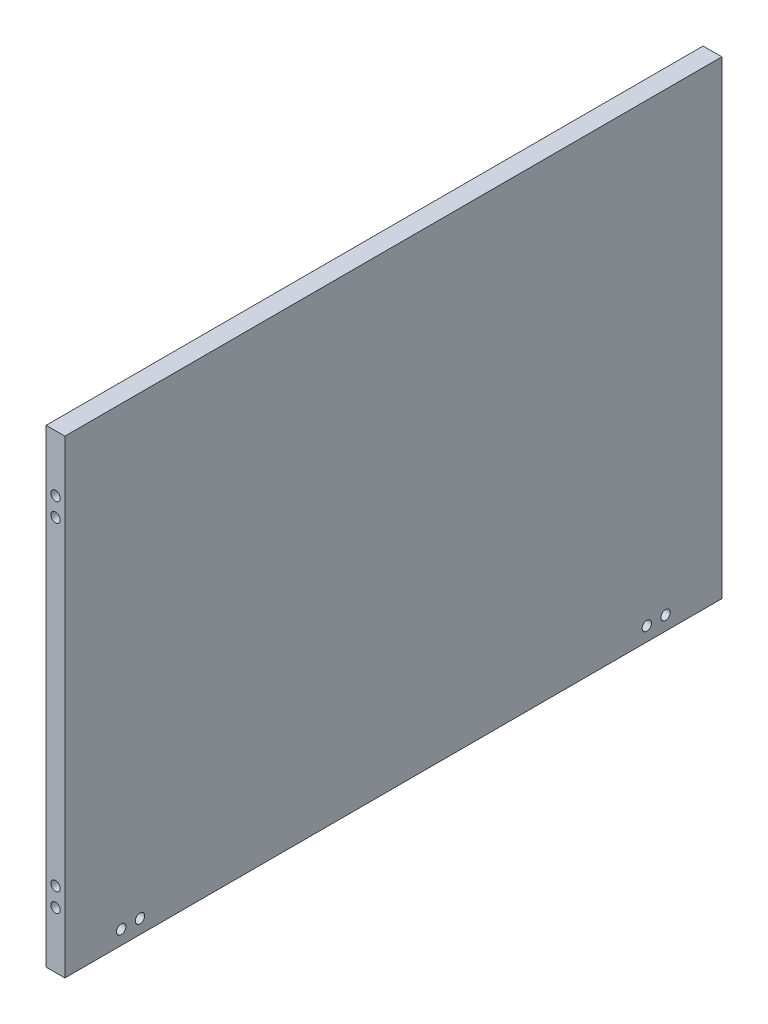
from build123d import *

# Parameters (mm, degrees)
SKETCH1_W           = 350
SKETCH1_H           = 250
BOSS_EXTRUDE1_DEPTH = 10
SKETCH2_R           = 2.5
CUT_EXTRUDE1_DEPTH  = 10
SKETCH3_R           = 2.5
CUT_EXTRUDE2_DEPTH  = 216.290501416


with BuildPart() as part:
    # Sketch1 → Boss-Extrude1 (new body)
    with BuildSketch(Plane(origin=(0, 0, 0), x_dir=(0, 0, -1), z_dir=(1, 0, 0))):
        Rectangle(SKETCH1_W, SKETCH1_H)
    extrude(amount=BOSS_EXTRUDE1_DEPTH)

    # Sketch2 → Cut-Extrude1 (cut)
    with BuildSketch(Plane.XY.offset(175)):
        with Locations((5, 95)):
            Circle(SKETCH2_R)
        with Locations((5, 85)):
            Circle(SKETCH2_R)
        with Locations((5, -85)):
            Circle(SKETCH2_R)
        with Locations((5, -95)):
            Circle(SKETCH2_R)
    cut_extrude1 = extrude(amount=-CUT_EXTRUDE1_DEPTH, mode=Mode.SUBTRACT)

    # Mirror1: Cut-Extrude1 across plane
    add(cut_extrude1.mirror(Plane.XY), mode=Mode.SUBTRACT)

    # Sketch3 → Cut-Extrude2 (cut, through all)
    with BuildSketch(Plane(origin=(10, 0, 0), x_dir=(0, 0, -1), z_dir=(1, 0, 0))):
        with Locations((-145, -117.5)):
            Circle(SKETCH3_R)
        with Locations((-135, -117.5)):
            Circle(SKETCH3_R)
        with Locations((135, -117.5)):
            Circle(SKETCH3_R)
        with Locations((145, -117.5)):
            Circle(SKETCH3_R)
    extrude(amount=-CUT_EXTRUDE2_DEPTH, mode=Mode.SUBTRACT)


solid = part.part
